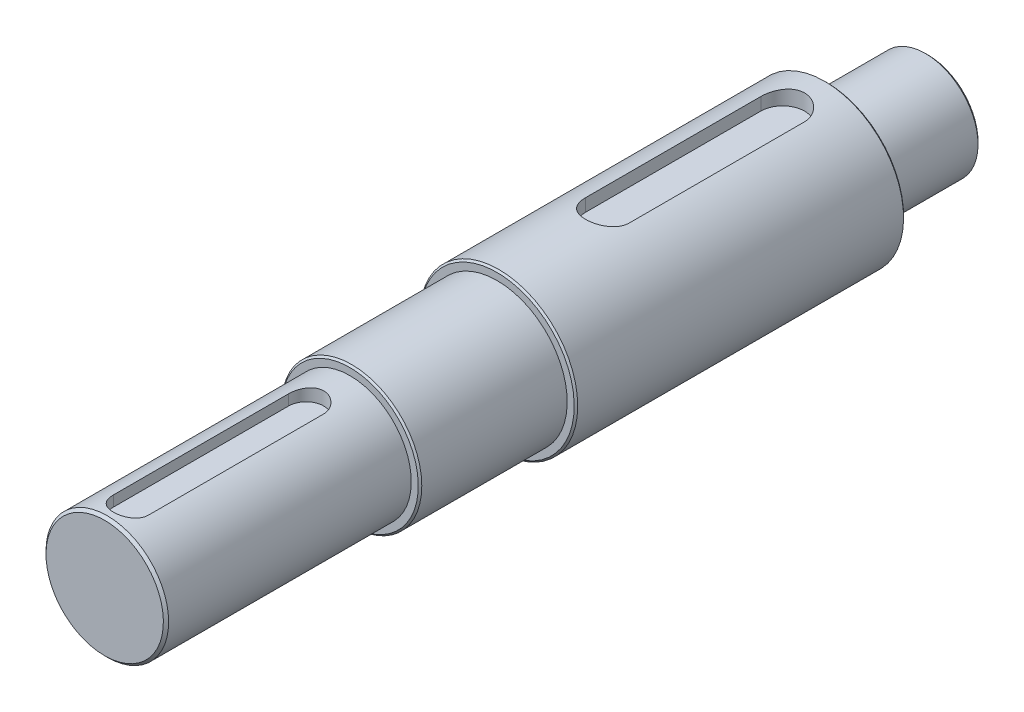
from build123d import *

# Parameters (mm, degrees)
CUT_EXTRUDE1_START = 27.5
CUT_EXTRUDE1_DEPTH = 10
CUT_EXTRUDE2_START = 36
CUT_EXTRUDE2_DEPTH = 10
CHAMFER1_SIZE      = 1.5
CHAMFER2_SIZE      = 1


with BuildPart() as part:
    # Sketch1 → Revolve1 (revolve)
    with BuildSketch(Plane(origin=(0, 0, 0), x_dir=(0, 0, -1), z_dir=(1, 0, 0))):
        Polygon((0, 0), (0, 35), (140, 35), (140, 40), (224, 40), (224, 45), (412, 45), (412, 30), (470, 30), (470, 0), align=None)
    revolve(axis=Axis((0, 0, -470), (0, 0, 1)))

    # Sketch2 → Cut-Extrude1 (cut)
    with BuildSketch(Plane(origin=(0, 0, 0), x_dir=(1, 0, 0), z_dir=(0, 1, 0)).offset(CUT_EXTRUDE1_START)):
        with BuildLine():
            Line((-10, 15), (-10, 115))
            ThreePointArc((-10, 115), (0, 125), (10, 115))
            Line((10, 115), (10, 15))
            ThreePointArc((10, 15), (0, 5), (-10, 15))
        make_face()
    extrude(amount=CUT_EXTRUDE1_DEPTH, mode=Mode.SUBTRACT)

    # Sketch4 → Cut-Extrude2 (cut)
    with BuildSketch(Plane(origin=(0, 0, 0), x_dir=(1, 0, 0), z_dir=(0, 1, 0)).offset(CUT_EXTRUDE2_START)):
        with BuildLine():
            Line((12.5, 387), (12.5, 287))
            ThreePointArc((12.5, 287), (0, 274.5), (-12.5, 287))
            Line((-12.5, 287), (-12.5, 387))
            ThreePointArc((-12.5, 387), (0, 399.5), (12.5, 387))
        make_face()
    extrude(amount=CUT_EXTRUDE2_DEPTH, mode=Mode.SUBTRACT)

    # Chamfer1
    chamfer1_edges = [part.edges().sort_by_distance(p)[0] for p in [
        (0, -35, 0),
        (0, -30, -470),
    ]]
    chamfer(chamfer1_edges, length=CHAMFER1_SIZE)

    # Chamfer2
    chamfer2_edges = [part.edges().sort_by_distance(p)[0] for p in [
        (0, -40, -140),
        (0, -45, -412),
        (0, -45, -224),
    ]]
    chamfer(chamfer2_edges, length=CHAMFER2_SIZE)


solid = part.part
